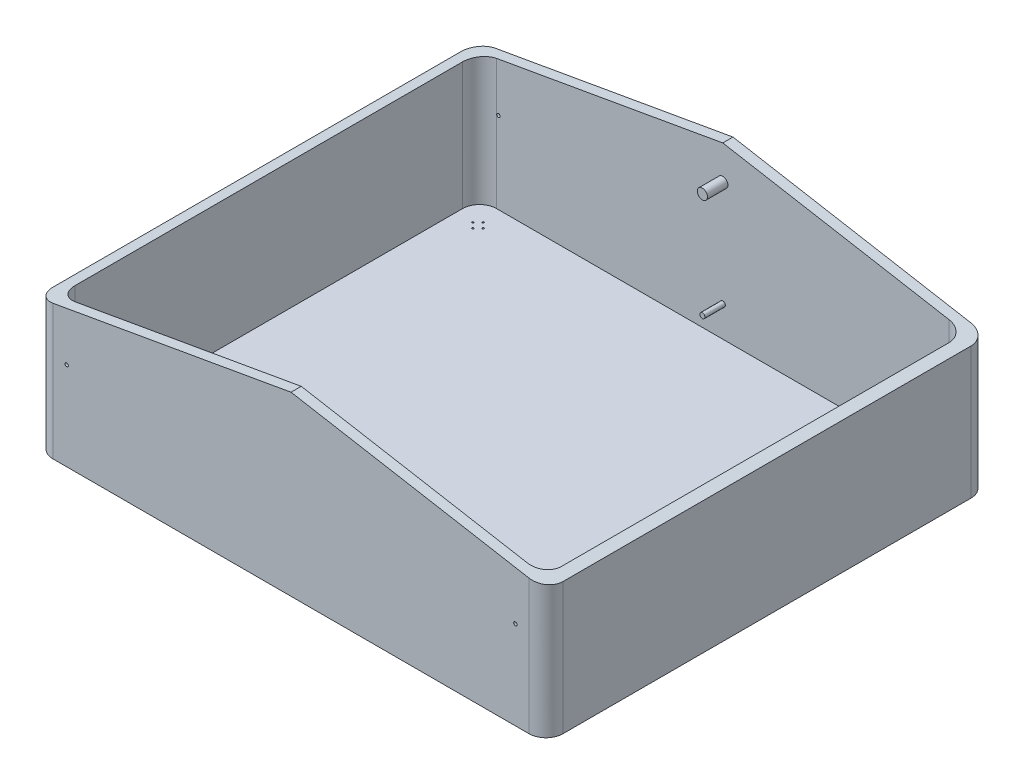
from build123d import *

# Parameters (mm, degrees)
EXTRUDE_1_DEPTH     = 20
EXTRUDE_2_DEPTH     = 500
SKETCH_3_R          = 2.5
CUT_EXTRUDE_1_DEPTH = 250
SKETCH_4_R          = 5
CUT_EXTRUDE_2_DEPTH = 1500
CUT_EXTRUDE_3_DEPTH = 1589.363938145
SKETCH_7_R          = 15
EXTRUDE_3_DEPTH     = 60
SKETCH_8_R          = 7.5
EXTRUDE_4_DEPTH     = 60


with BuildPart() as part:
    # Эскиз1 → Бобышка-Вытянуть1 (new body)
    with BuildSketch(Plane(origin=(0, 0, 0), x_dir=(1, 0, 0), z_dir=(0, 1, 0))):
        with BuildLine():
            Line((-700, -650), (700, -650))
            ThreePointArc((700, -650), (735.355339059, -635.355339059), (750, -600))
            Line((750, -600), (750, 600))
            ThreePointArc((750, 600), (735.355339059, 635.355339059), (700, 650))
            Line((700, 650), (-700, 650))
            ThreePointArc((-700, 650), (-735.355339059, 635.355339059), (-750, 600))
            Line((-750, 600), (-750, -600))
            ThreePointArc((-750, -600), (-735.355339059, -635.355339059), (-700, -650))
        make_face()
    extrude(amount=EXTRUDE_1_DEPTH)

    # Эскиз2 → Бобышка-Вытянуть2 (add)
    with BuildSketch(Plane(origin=(0, 20, 0), x_dir=(1, 0, 0), z_dir=(0, 1, 0))):
        with BuildLine():
            Line((700, -650), (-700, -650))
            ThreePointArc((-700, -650), (-735.355339059, -635.355339059), (-750, -600))
            Line((-750, -600), (-750, 600))
            ThreePointArc((-750, 600), (-735.355339059, 635.355339059), (-700, 650))
            Line((-700, 650), (700, 650))
            ThreePointArc((700, 650), (735.355339059, 635.355339059), (750, 600))
            Line((750, 600), (750, -600))
            ThreePointArc((750, -600), (735.355339059, -635.355339059), (700, -650))
        make_face()
        with BuildLine():
            Line((665.384615385, -620), (-665.384615385, -620))
            ThreePointArc((-665.384615385, -620), (-700.739954444, -605.355339059), (-715.384615385, -570))
            Line((-715.384615385, -570), (-715.384615385, 570))
            ThreePointArc((-715.384615385, 570), (-700.739954444, 605.355339059), (-665.384615385, 620))
            Line((-665.384615385, 620), (665.384615385, 620))
            ThreePointArc((665.384615385, 620), (700.739954444, 605.355339059), (715.384615385, 570))
            Line((715.384615385, 570), (715.384615385, -570))
            ThreePointArc((715.384615385, -570), (700.739954444, -605.355339059), (665.384615385, -620))
        make_face(mode=Mode.SUBTRACT)
    extrude(amount=EXTRUDE_2_DEPTH)

    # Эскиз3 → Вырез-Вытянуть1 (cut)
    with BuildSketch(Plane.XZ):
        with Locations(Location((-650, -565, 0), (0, 0, 270))):
            Circle(SKETCH_3_R)
        with Locations(Location((-650, 565, 0), (0, 0, 270))):
            Circle(SKETCH_3_R)
        with Locations(Location((-665, 550, 0), (0, 0, 270))):
            Circle(SKETCH_3_R)
        with Locations(Location((-635, 550, 0), (0, 0, 270))):
            Circle(SKETCH_3_R)
        with Locations(Location((-650, 535, 0), (0, 0, 270))):
            Circle(SKETCH_3_R)
        with Locations(Location((665, 550, 0), (0, 0, 270))):
            Circle(SKETCH_3_R)
        with Locations(Location((650, 565, 0), (0, 0, 270))):
            Circle(SKETCH_3_R)
        with Locations(Location((635, 550, 0), (0, 0, 270))):
            Circle(SKETCH_3_R)
        with Locations(Location((650, 535, 0), (0, 0, 270))):
            Circle(SKETCH_3_R)
        with Locations(Location((650, -535, 0), (0, 0, 270))):
            Circle(SKETCH_3_R)
        with Locations(Location((635, -550, 0), (0, 0, 270))):
            Circle(SKETCH_3_R)
        with Locations(Location((665, -550, 0), (0, 0, 270))):
            Circle(SKETCH_3_R)
        with Locations(Location((650, -565, 0), (0, 0, 270))):
            Circle(SKETCH_3_R)
        with Locations(Location((-650, -535, 0), (0, 0, 270))):
            Circle(SKETCH_3_R)
        with Locations(Location((-665, -550, 0), (0, 0, 270))):
            Circle(SKETCH_3_R)
        with Locations(Location((-635, -550, 0), (0, 0, 270))):
            Circle(SKETCH_3_R)
    extrude(amount=-CUT_EXTRUDE_1_DEPTH, mode=Mode.SUBTRACT)

    # Эскиз4 → Вырез-Вытянуть2 (cut)
    with BuildSketch(Plane(origin=(0, 0, -650), x_dir=(-1, 0, 0), z_dir=(0, 0, -1))):
        with Locations((660, 260)):
            Circle(SKETCH_4_R)
    cut_extrude_2 = extrude(amount=-CUT_EXTRUDE_2_DEPTH, mode=Mode.SUBTRACT)

    # Зеркальное отражение1: Вырез-Вытянуть2 across plane
    add(cut_extrude_2.mirror(Plane.ZY), mode=Mode.SUBTRACT)

    # Эскиз6 → Вырез-Вытянуть3 (cut, through all)
    with BuildSketch(Plane(origin=(0, 0, -650), x_dir=(-1, 0, 0), z_dir=(0, 0, -1))):
        Polygon((-700, 396.571113504), (-700, 520), (-801.122226931, 520), (-801.122226931, 378.740536547), align=None)
        Polygon((-700, 396.571113504), (0, 520), (-700, 520), align=None)
        Polygon((700, 520), (0, 520), (700, 396.571113504), align=None)
        Polygon((700, 520), (700, 396.571113504), (801.122226931, 378.740536547), (801.122226931, 520), align=None)
    extrude(amount=-CUT_EXTRUDE_3_DEPTH, mode=Mode.SUBTRACT)

    # Эскиз7 → Бобышка-Вытянуть3 (add)
    with BuildSketch(Plane(origin=(0, 0, 620), x_dir=(-1, 0, 0), z_dir=(0, 0, -1))):
        with Locations((0, 420)):
            Circle(SKETCH_7_R)
    extrude_3 = extrude(amount=EXTRUDE_3_DEPTH)

    # Зеркальное отражение2: Бобышка-Вытянуть3 across plane
    add(extrude_3.mirror(Plane(origin=(0, 0, 0), x_dir=(1, 0, 0), z_dir=(0, 0, -1))))

    # Эскиз8 → Бобышка-Вытянуть4 (add)
    with BuildSketch(Plane(origin=(0, 0, 620), x_dir=(-1, 0, 0), z_dir=(0, 0, -1))):
        with Locations((0, 110)):
            Circle(SKETCH_8_R)
    extrude_4 = extrude(amount=EXTRUDE_4_DEPTH)

    # Зеркальное отражение3: Бобышка-Вытянуть4 across plane
    add(extrude_4.mirror(Plane(origin=(0, 0, 0), x_dir=(1, 0, 0), z_dir=(0, 0, -1))))


solid = part.part
